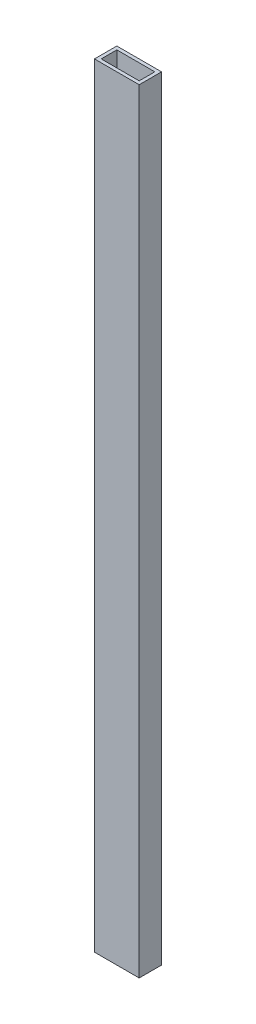
from build123d import *

# Parameters (mm, degrees)
SKETCH1_W           = 20
SKETCH1_H           = 10
BOSS_EXTRUDE1_DEPTH = 346
SKETCH2_W           = 17
SKETCH2_H           = 7
CUT_EXTRUDE1_DEPTH  = 347.180588711


with BuildPart() as part:
    # Sketch1 → Boss-Extrude1 (new body)
    with BuildSketch(Plane(origin=(0, 0, 0), x_dir=(1, 0, 0), z_dir=(0, 1, 0))):
        Rectangle(SKETCH1_W, SKETCH1_H)
    extrude(amount=BOSS_EXTRUDE1_DEPTH)

    # Sketch2 → Cut-Extrude1 (cut, through all)
    with BuildSketch(Plane.XZ):
        Rectangle(SKETCH2_W, SKETCH2_H)
    extrude(amount=-CUT_EXTRUDE1_DEPTH, mode=Mode.SUBTRACT)


solid = part.part
